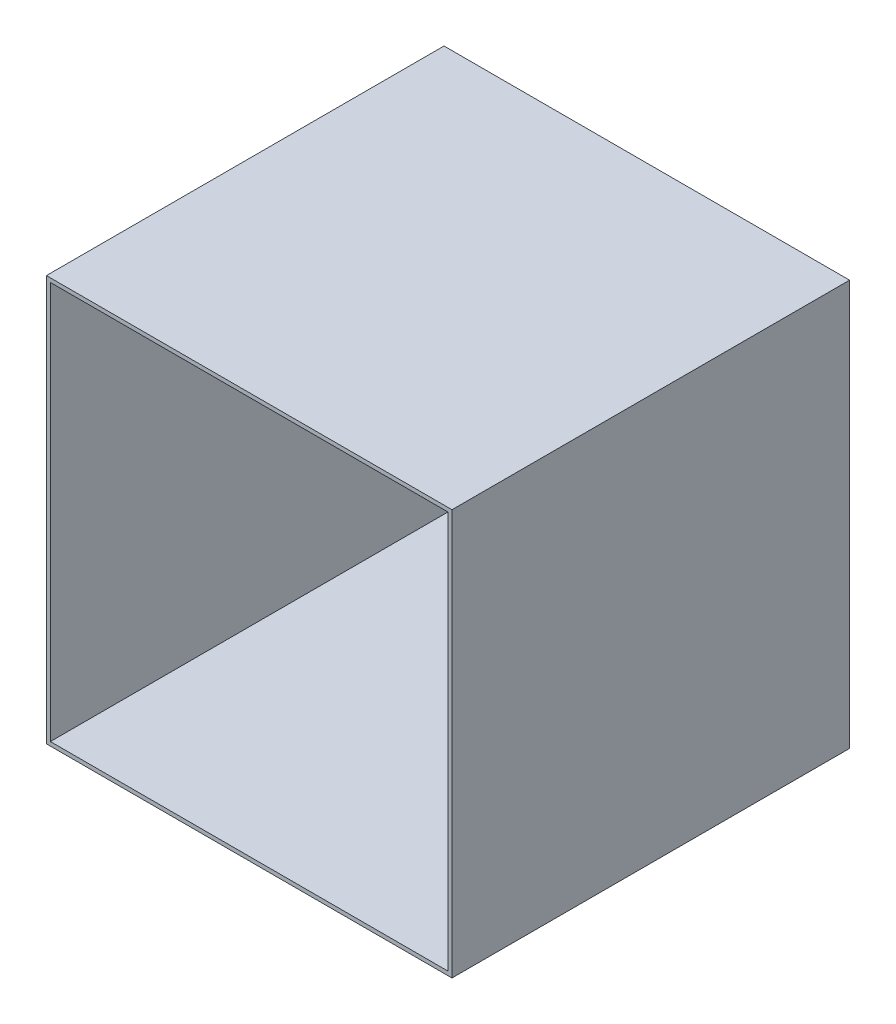
from build123d import *

# Parameters (mm, degrees)
SKETCH_1_W      = 204
SKETCH_1_H      = 204
SKETCH_1_W_2    = 200
SKETCH_1_H_2    = 200
EXTRUDE_1_DEPTH = 200


with BuildPart() as part:
    # Эскиз1 → Вытянуть-Тонкостенный1 (new body)
    with BuildSketch(Plane.XY):
        with Locations((-4.156513972, 21.178249185)):
            Rectangle(SKETCH_1_W, SKETCH_1_H)
        with Locations((-4.156513972, 21.178249185)):
            Rectangle(SKETCH_1_W_2, SKETCH_1_H_2, mode=Mode.SUBTRACT)
    extrude(amount=EXTRUDE_1_DEPTH)


solid = part.part
